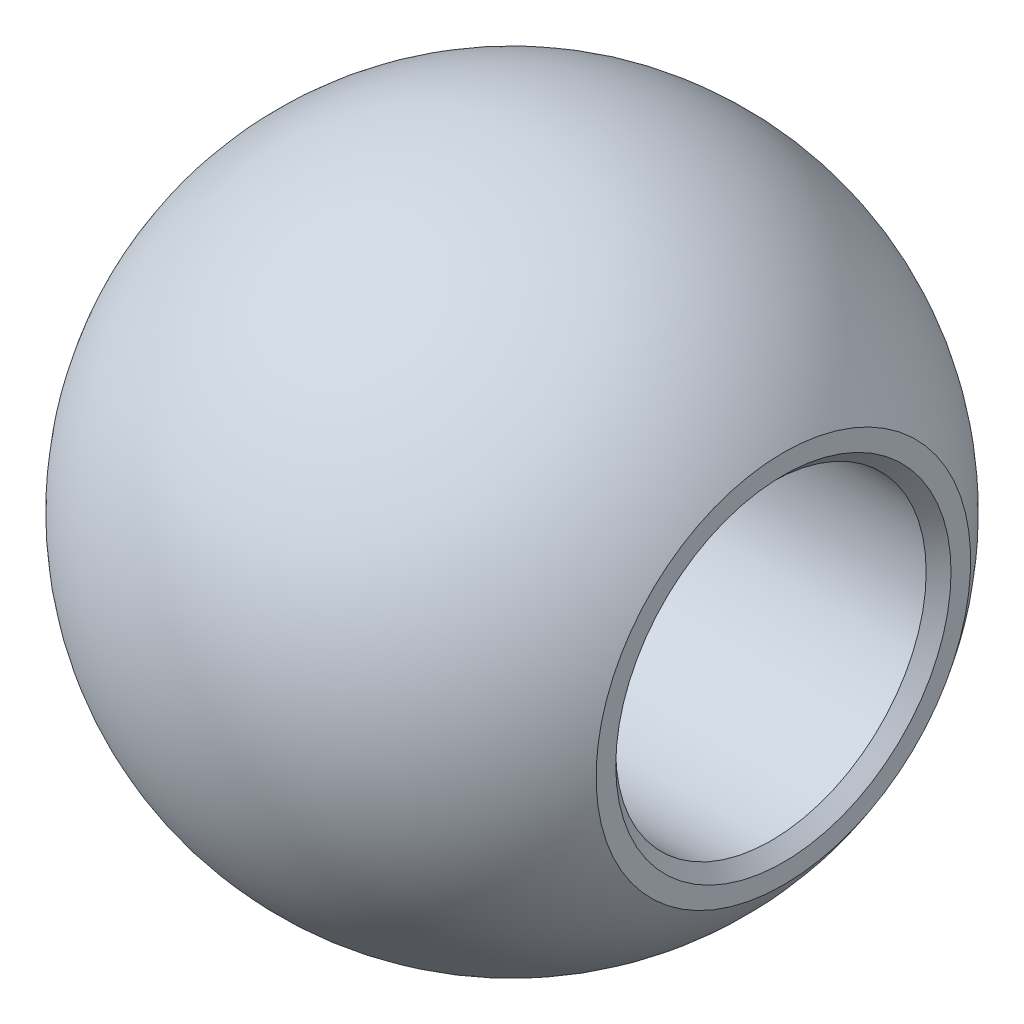
from build123d import *

# Parameters (mm, degrees)
CHAMFER1_SIZE = 0.254


with BuildPart() as part:
    # Sketch1 → Revolve1 (revolve)
    with BuildSketch(Plane.XY):
        with BuildLine():
            Line((-5.5499, 3.830939791), (-5.5499, 3.175))
            Line((-5.5499, 3.175), (5.5499, 3.175))
            Line((5.5499, 3.175), (5.5499, 3.830939791))
            ThreePointArc((5.5499, 3.830939791), (0, 6.7437), (-5.5499, 3.830939791))
        make_face()
    revolve(axis=Axis((-6.885146645, 0, 0), (1, 0, 0)))

    # Chamfer1
    chamfer1_edges = [part.edges().sort_by_distance(p)[0] for p in [
        (5.5499, -3.175, 0),
        (-5.5499, -3.175, 0),
    ]]
    chamfer(chamfer1_edges, length=CHAMFER1_SIZE)


solid = part.part
